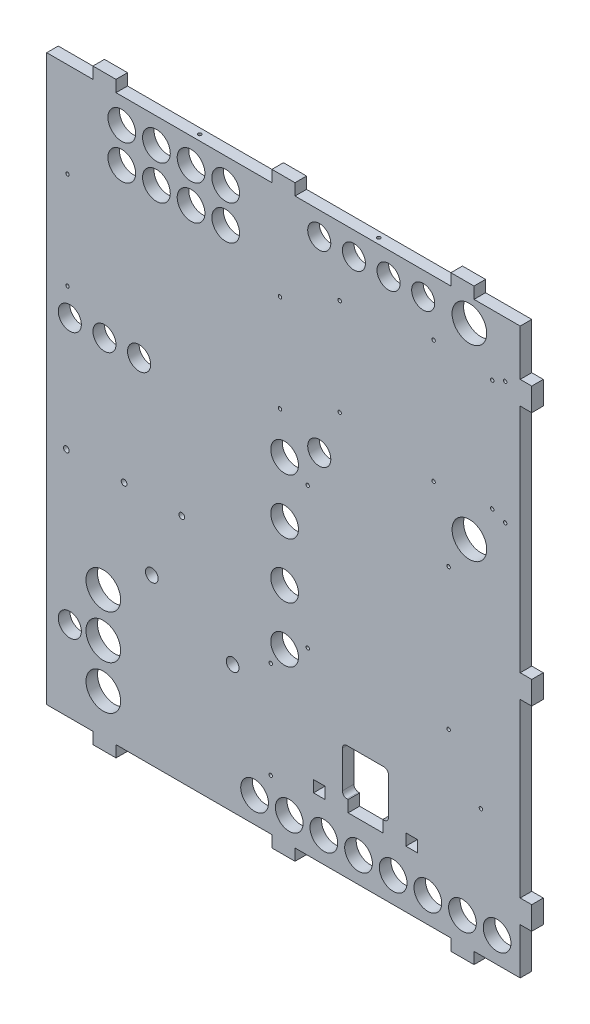
from build123d import *
from build123d.topology import SkipClean

# Parameters (mm, degrees)
SKIZZE1_W                       = 5
SKIZZE1_H                       = 5
SKIZZE1_W_2                     = 15
AUFSATZ_LINEAR_AUSTRAGEN1_DEPTH = 5
SKIZZE2_R                       = 2.75
SCHNITT_LINEAR_AUSTRAGEN1_DEPTH = 128.539996178
SCHNITT_LINEAR_AUSTRAGEN2_DEPTH = 128.539996178
SKIZZE4_R                       = 7.5
SCHNITT_LINEAR_AUSTRAGEN3_DEPTH = 128.539996178
SKIZZE5_R                       = 0.75
SKIZZE5_R_2                     = 6
SENSORS_DEPTH                   = 128.539996178
AUFSATZ_LINEAR_AUSTRAGEN2_DEPTH = 5
SKIZZE7_R                       = 1.25
SCHNITT_LINEAR_AUSTRAGEN5_DEPTH = 239.81729549
SKETCH1_W                       = 69.5
SKETCH1_H                       = 110
BOSS_EXTRUDE1_DEPTH             = 5
SKIZZE9_R                       = 0.75
SKIZZE9_R_2                     = 6
DISCRETECHANNEL_DEPTH           = 239.81729549
SKIZZE10_R                      = 0.75
SKIZZE10_R_2                    = 6
CONTCHANNEL_DEPTH               = 239.81729549
BOSS_EXTRUDE2_DEPTH             = 5
SKIZZE8_R                       = 0.75
SKIZZE8_R_2                     = 7.5
STEPDOWNCONVERTER_DEPTH         = 239.81729549
SKETCH3_R                       = 0.75
SKETCH3_R_2                     = 5
BBB_DEPTH                       = 5
BOSS_EXTRUDE3_DEPTH             = 5
SKETCH5_W                       = 55
SKETCH5_H                       = 244.45
CUT_EXTRUDE2_DEPTH              = 5
SKETCH6_R                       = 5
CUT_EXTRUDE3_DEPTH              = 5
SKETCH7_W                       = 5
SKETCH7_H                       = 10
BOSS_EXTRUDE4_DEPTH             = 5
SKETCH8_W                       = 10
SKETCH8_H                       = 5
BOSS_EXTRUDE5_DEPTH             = 5
SKETCH10_R                      = 0.75
CUT_EXTRUDE4_DEPTH              = 10


with BuildPart() as part:
    # Skizze1 → Aufsatz-Linear austragen1 (new body)
    with BuildSketch(Plane.XY):
        Polygon((55, 67.225), (75, 67.225), (75, 72.225), (85, 72.225), (85, 67.225), (100, 67.225), (100, 47.225), (105, 47.225), (105, 37.225), (100, 37.225), (100, -37.225), (105, -37.225), (105, -47.225), (100, -47.225), (100, -67.225), (-100, -67.225), (-100, -47.225), (-105, -47.225), (-105, -37.225), (-100, -37.225), (-100, 37.225), (-105, 37.225), (-105, 47.225), (-100, 47.225), (-100, 67.225), (-85, 67.225), (-85, 72.225), (-75, 72.225), (-75, 67.225), (45, 67.225), (45, 72.225), (55, 72.225), align=None)
        with Locations((13, -40.055)):
            Rectangle(SKIZZE1_W, SKIZZE1_H, mode=Mode.SUBTRACT)
        with Locations((53, -40.055)):
            Rectangle(SKIZZE1_W, SKIZZE1_H, mode=Mode.SUBTRACT)
        with Locations((33, -40.055)):
            Rectangle(SKIZZE1_W_2, SKIZZE1_H, mode=Mode.SUBTRACT)
    extrude(amount=AUFSATZ_LINEAR_AUSTRAGEN1_DEPTH)

    # Skizze2 → Schnitt-Linear austragen1 (cut, through all)
    with BuildSketch(Plane.XY.offset(5)):
        with Locations((-59.5, 4.075)):
            Circle(SKIZZE2_R)
        with Locations((-24.5, -11.925)):
            Circle(SKIZZE2_R)
    extrude(amount=-SCHNITT_LINEAR_AUSTRAGEN1_DEPTH, mode=Mode.SUBTRACT)

    # Skizze3 → Schnitt-Linear austragen2 (cut, through all)
    with BuildSketch(Plane.XY.offset(5)):
        with BuildLine():
            Line((25, -17.555), (41, -17.555))
            ThreePointArc((41, -17.555), (42.414213562, -18.140786438), (43, -19.555))
            Line((43, -19.555), (43, -35.555))
            ThreePointArc((43, -35.555), (42.414213562, -36.969213562), (41, -37.555))
            Line((41, -37.555), (37, -37.555))
            Line((37, -37.555), (29, -37.555))
            Line((29, -37.555), (25, -37.555))
            ThreePointArc((25, -37.555), (23.585786438, -36.969213562), (23, -35.555))
            Line((23, -35.555), (23, -19.555))
            ThreePointArc((23, -19.555), (23.585786438, -18.140786438), (25, -17.555))
        make_face()
        with BuildLine():
            Line((-66.5, 54.225), (-66.5, 35.225))
            ThreePointArc((-66.5, 35.225), (-67.378679656, 33.103679656), (-69.5, 32.225))
            Line((-69.5, 32.225), (-88.5, 32.225))
            ThreePointArc((-88.5, 32.225), (-90.621320344, 33.103679656), (-91.5, 35.225))
            Line((-91.5, 35.225), (-91.5, 54.225))
            ThreePointArc((-91.5, 54.225), (-90.621320344, 56.346320344), (-88.5, 57.225))
            Line((-88.5, 57.225), (-69.5, 57.225))
            ThreePointArc((-69.5, 57.225), (-67.378679656, 56.346320344), (-66.5, 54.225))
        make_face()
        with BuildLine():
            Line((4.5, 57.225), (-14.5, 57.225))
            ThreePointArc((-14.5, 57.225), (-16.621320344, 56.346320344), (-17.5, 54.225))
            Line((-17.5, 54.225), (-17.5, 35.225))
            ThreePointArc((-17.5, 35.225), (-16.621320344, 33.103679656), (-14.5, 32.225))
            Line((-14.5, 32.225), (4.5, 32.225))
            ThreePointArc((4.5, 32.225), (6.621320344, 33.103679656), (7.5, 35.225))
            Line((7.5, 35.225), (7.5, 54.225))
            ThreePointArc((7.5, 54.225), (6.621320344, 56.346320344), (4.5, 57.225))
        make_face()
    extrude(amount=-SCHNITT_LINEAR_AUSTRAGEN2_DEPTH, mode=Mode.SUBTRACT)

    # Skizze4 → Schnitt-Linear austragen3 (cut, through all)
    with BuildSketch(Plane.XY.offset(5)):
        with Locations((-80.5, -30.925)):
            Circle(SKIZZE4_R)
        with Locations((-80.5, -11.925)):
            Circle(SKIZZE4_R)
        with Locations(Location((-80.5, -49.925, 0), (0, 0, 180))):
            Circle(SKIZZE4_R)
    extrude(amount=-SCHNITT_LINEAR_AUSTRAGEN3_DEPTH, mode=Mode.SUBTRACT)

    # Skizze5 → Sensors (cut, through all)
    with BuildSketch(Plane.XY.offset(5)):
        with Locations((-8, -45.225)):
            Circle(SKIZZE5_R)
        with Locations((-8, -3.225)):
            Circle(SKIZZE5_R)
        with Locations((83, -12.225)):
            Circle(SKIZZE5_R)
        with Locations((-15, -56.225)):
            Circle(SKIZZE5_R_2)
        with Locations((0, -56.225)):
            Circle(SKIZZE5_R_2)
        with Locations((15, -56.225)):
            Circle(SKIZZE5_R_2)
        with Locations((30, -56.225)):
            Circle(SKIZZE5_R_2)
        with Locations((45, -56.225)):
            Circle(SKIZZE5_R_2)
        with Locations((60, -56.225)):
            Circle(SKIZZE5_R_2)
        with Locations((75, -56.225)):
            Circle(SKIZZE5_R_2)
        with Locations((90, -56.225)):
            Circle(SKIZZE5_R_2)
    extrude(amount=-SENSORS_DEPTH, mode=Mode.SUBTRACT)

    # Skizze6 → Aufsatz-Linear austragen2 (add)
    with BuildSketch(Plane(origin=(0, 0, 0), x_dir=(-1, 0, 0), z_dir=(0, 0, -1))):
        Polygon((160, 47.225), (160, 37.225), (160, -37.225), (160, -47.225), (160, -67.225), (100, -67.225), (100, 67.225), (-30.5, 67.225), (-30.5, 177.225), (160, 177.225), (160, 67.225), align=None)
    extrude(amount=-AUFSATZ_LINEAR_AUSTRAGEN2_DEPTH)

    # Skizze7 → Schnitt-Linear austragen5 (cut, through all)
    with BuildSketch(Plane(origin=(0, 0, 0), x_dir=(-1, 0, 0), z_dir=(0, 0, -1))):
        with Locations((71.5, 32.775)):
            Circle(SKIZZE7_R)
        with Locations((96.5, 32.775)):
            Circle(SKIZZE7_R)
        with Locations((46.5, 32.775)):
            Circle(SKIZZE7_R)
    extrude(amount=-SCHNITT_LINEAR_AUSTRAGEN5_DEPTH, mode=Mode.SUBTRACT)

    # Sketch1 → Boss-Extrude1 (add)
    with BuildSketch(Plane.XY.offset(5)):
        with Locations((65.25, 122.225)):
            Rectangle(SKETCH1_W, SKETCH1_H)
    extrude(amount=-BOSS_EXTRUDE1_DEPTH)

    # Skizze9 → DiscreteChannel (cut, through all)
    with BuildSketch(Plane.XY.offset(5)):
        with Locations((8, 71.515)):
            Circle(SKIZZE9_R)
        with Locations(Location((69, 71.515, 0), (0, 0, 180))):
            Circle(SKIZZE9_R)
        with Locations(Location((8, 10.515, 0), (0, 0, 180))):
            Circle(SKIZZE9_R)
        with Locations((69, 10.515)):
            Circle(SKIZZE9_R)
        with Locations((-2, 5.015)):
            Circle(SKIZZE9_R_2)
        with Locations((-2, 29.015)):
            Circle(SKIZZE9_R_2)
        with Locations((-2, 53.015)):
            Circle(SKIZZE9_R_2)
        with Locations((-2, 77.015)):
            Circle(SKIZZE9_R_2)
    extrude(amount=-DISCRETECHANNEL_DEPTH, mode=Mode.SUBTRACT)

    # Skizze10 → ContChannel (cut, through all)
    with BuildSketch(Plane.XY.offset(5)):
        with Locations((-4, 136.225)):
            Circle(SKIZZE10_R)
        with Locations(Location((-4, 94.225, 0), (0, 0, 180))):
            Circle(SKIZZE10_R)
        with Locations(Location((-96, 136.225, 0), (0, 0, 180))):
            Circle(SKIZZE10_R)
        with Locations((-96, 94.225)):
            Circle(SKIZZE10_R)
        with Locations((-72.499999267, 166.225)):
            Circle(SKIZZE10_R_2)
        with Locations((-57.499999267, 166.225)):
            Circle(SKIZZE10_R_2)
        with Locations((-42.499999267, 166.225)):
            Circle(SKIZZE10_R_2)
        with Locations((-27.499999267, 166.225)):
            Circle(SKIZZE10_R_2)
        with Locations((-27.499999267, 151.225)):
            Circle(SKIZZE10_R_2)
        with Locations((-42.499999267, 151.225)):
            Circle(SKIZZE10_R_2)
        with Locations((-57.499999267, 151.225)):
            Circle(SKIZZE10_R_2)
        with Locations((-72.499999267, 151.225)):
            Circle(SKIZZE10_R_2)
    extrude(amount=-CONTCHANNEL_DEPTH, mode=Mode.SUBTRACT)

    # Sketch2 → Boss-Extrude2 (add)
    with SkipClean():  # the faces are left unmerged after this step: merging them gives an invalid solid
        with BuildSketch(Plane.XY.offset(5)):
            with BuildLine():
                Line((-14.5, 32.225), (-7.069112348, 32.225))
                ThreePointArc((-7.069112348, 32.225), (-2, 35.015), (3.069112348, 32.225))
                Line((3.069112348, 32.225), (4.5, 32.225))
                ThreePointArc((4.5, 32.225), (6.621320344, 33.103679656), (7.5, 35.225))
                Line((7.5, 35.225), (7.5, 54.225))
                ThreePointArc((7.5, 54.225), (6.621320344, 56.346320344), (4.5, 57.225))
                Line((4.5, 57.225), (2.275032164, 57.225))
                ThreePointArc((2.275032164, 57.225), (-2, 47.015), (-6.275032164, 57.225))
                Line((-6.275032164, 57.225), (-14.5, 57.225))
                ThreePointArc((-14.5, 57.225), (-16.621320344, 56.346320344), (-17.5, 54.225))
                Line((-17.5, 54.225), (-17.5, 35.225))
                ThreePointArc((-17.5, 35.225), (-16.621320344, 33.103679656), (-14.5, 32.225))
            make_face()
        extrude(amount=-BOSS_EXTRUDE2_DEPTH)

    # Skizze8 → StepDownConverter (cut, through all)
    with SkipClean():  # the faces are left unmerged after this step: merging them gives an invalid solid
        with BuildSketch(Plane.XY.offset(5)):
            with Locations((62.5, 153.225)):
                Circle(SKIZZE8_R)
            with Locations(Location((93.5, 153.225, 0), (0, 0, 180))):
                Circle(SKIZZE8_R)
            with Locations(Location((62.5, 100.225, 0), (0, 0, 180))):
                Circle(SKIZZE8_R)
            with Locations((93.5, 100.225)):
                Circle(SKIZZE8_R)
            with Locations((78, 86.225)):
                Circle(SKIZZE8_R_2)
            with Locations(Location((78, 167.225, 0), (0, 0, 180))):
                Circle(SKIZZE8_R_2)
        extrude(amount=-STEPDOWNCONVERTER_DEPTH, mode=Mode.SUBTRACT)

    # Sketch3 → BBB (cut)
    with SkipClean():  # the faces are left unmerged after this step: merging them gives an invalid solid
        with BuildSketch(Plane.XY.offset(5)):
            with Locations((21.85, 147.68)):
                Circle(SKETCH3_R)
            with Locations((87.89, 102.59)):
                Circle(SKETCH3_R)
            with Locations(Location((87.89, 150.86, 0), (0, 0, 180))):
                Circle(SKETCH3_R)
            with Locations(Location((21.85, 105.77, 0), (0, 0, 180))):
                Circle(SKETCH3_R)
            with Locations((13, 167.225)):
                Circle(SKETCH3_R_2)
            with Locations((28, 167.225)):
                Circle(SKETCH3_R_2)
            with Locations((43, 167.225)):
                Circle(SKETCH3_R_2)
            with Locations((58, 167.225)):
                Circle(SKETCH3_R_2)
            with Locations(Location((13, 86.225, 0), (0, 0, 180))):
                Circle(SKETCH3_R_2)
        extrude(amount=-BBB_DEPTH, mode=Mode.SUBTRACT)

    # Sketch4 → Boss-Extrude3 (add)
    with SkipClean():  # the faces are left unmerged after this step: merging them gives an invalid solid
        with BuildSketch(Plane.XY.offset(5)):
            with BuildLine():
                Line((-88.5, 32.225), (-72.622497216, 32.225))
                ThreePointArc((-72.622497216, 32.225), (-71.5, 34.025), (-70.377502784, 32.225))
                Line((-70.377502784, 32.225), (-69.5, 32.225))
                ThreePointArc((-69.5, 32.225), (-67.378679656, 33.103679656), (-66.5, 35.225))
                Line((-66.5, 35.225), (-66.5, 54.225))
                ThreePointArc((-66.5, 54.225), (-67.378679656, 56.346320344), (-69.5, 57.225))
                Line((-69.5, 57.225), (-88.5, 57.225))
                ThreePointArc((-88.5, 57.225), (-90.621320344, 56.346320344), (-91.5, 54.225))
                Line((-91.5, 54.225), (-91.5, 35.225))
                ThreePointArc((-91.5, 35.225), (-90.621320344, 33.103679656), (-88.5, 32.225))
            make_face()
        extrude(amount=-BOSS_EXTRUDE3_DEPTH)

    # Sketch5 → Cut-Extrude2 (cut)
    with SkipClean():  # the faces are left unmerged after this step: merging them gives an invalid solid
        with BuildSketch(Plane.XY.offset(5)):
            with Locations((-132.5, 55)):
                Rectangle(SKETCH5_W, SKETCH5_H)
        extrude(amount=-CUT_EXTRUDE2_DEPTH, mode=Mode.SUBTRACT)

    # Sketch6 → Cut-Extrude3 (cut)
    with SkipClean():  # the faces are left unmerged after this step: merging them gives an invalid solid
        with BuildSketch(Plane.XY.offset(5)):
            with Locations((-95, 82.775)):
                Circle(SKETCH6_R)
            with Locations((-80, 82.775)):
                Circle(SKETCH6_R)
            with Locations((-95, -32.225)):
                Circle(SKETCH6_R)
            with Locations((-65, 82.775)):
                Circle(SKETCH6_R)
        extrude(amount=-CUT_EXTRUDE3_DEPTH, mode=Mode.SUBTRACT)

    # Sketch7 → Boss-Extrude4 (add)
    with SkipClean():  # the faces are left unmerged after this step: merging them gives an invalid solid
        with BuildSketch(Plane.XY.offset(5)):
            with Locations((102.5, 152.225)):
                Rectangle(SKETCH7_W, SKETCH7_H)
        extrude(amount=-BOSS_EXTRUDE4_DEPTH)

    # Sketch8 → Boss-Extrude5 (add)
    with SkipClean():  # the faces are left unmerged after this step: merging them gives an invalid solid
        with BuildSketch(Plane.XY.offset(5)):
            with Locations((-80, -69.725)):
                Rectangle(SKETCH8_W, SKETCH8_H)
            with Locations((-2.5, -69.725)):
                Rectangle(SKETCH8_W, SKETCH8_H)
            with Locations((75, -69.725)):
                Rectangle(SKETCH8_W, SKETCH8_H)
            with Locations((75, 179.725)):
                Rectangle(SKETCH8_W, SKETCH8_H)
            with Locations((-2.5, 179.725)):
                Rectangle(SKETCH8_W, SKETCH8_H)
            with Locations((-80, 179.725)):
                Rectangle(SKETCH8_W, SKETCH8_H)
        extrude(amount=-BOSS_EXTRUDE5_DEPTH)

    # Sketch10 → Cut-Extrude4 (cut)
    with SkipClean():  # the faces are left unmerged after this step: merging them gives an invalid solid
        with BuildSketch(Plane(origin=(0, 177.225, 0), x_dir=(1, 0, 0), z_dir=(0, 1, 0))):
            with Locations(Location((36.25, -2.5, 0), (0, 0, 270))):
                Circle(SKETCH10_R)
            with Locations(Location((-41.25, -2.5, 0), (0, 0, 270))):
                Circle(SKETCH10_R)
        cut_extrude4 = extrude(amount=-CUT_EXTRUDE4_DEPTH, mode=Mode.SUBTRACT)

    # Mirror1: Cut-Extrude4 across plane
    with SkipClean():  # the faces are left unmerged after this step: merging them gives an invalid solid
        add(cut_extrude4.mirror(Plane.ZX.offset(55)), mode=Mode.SUBTRACT)


solid = part.part
